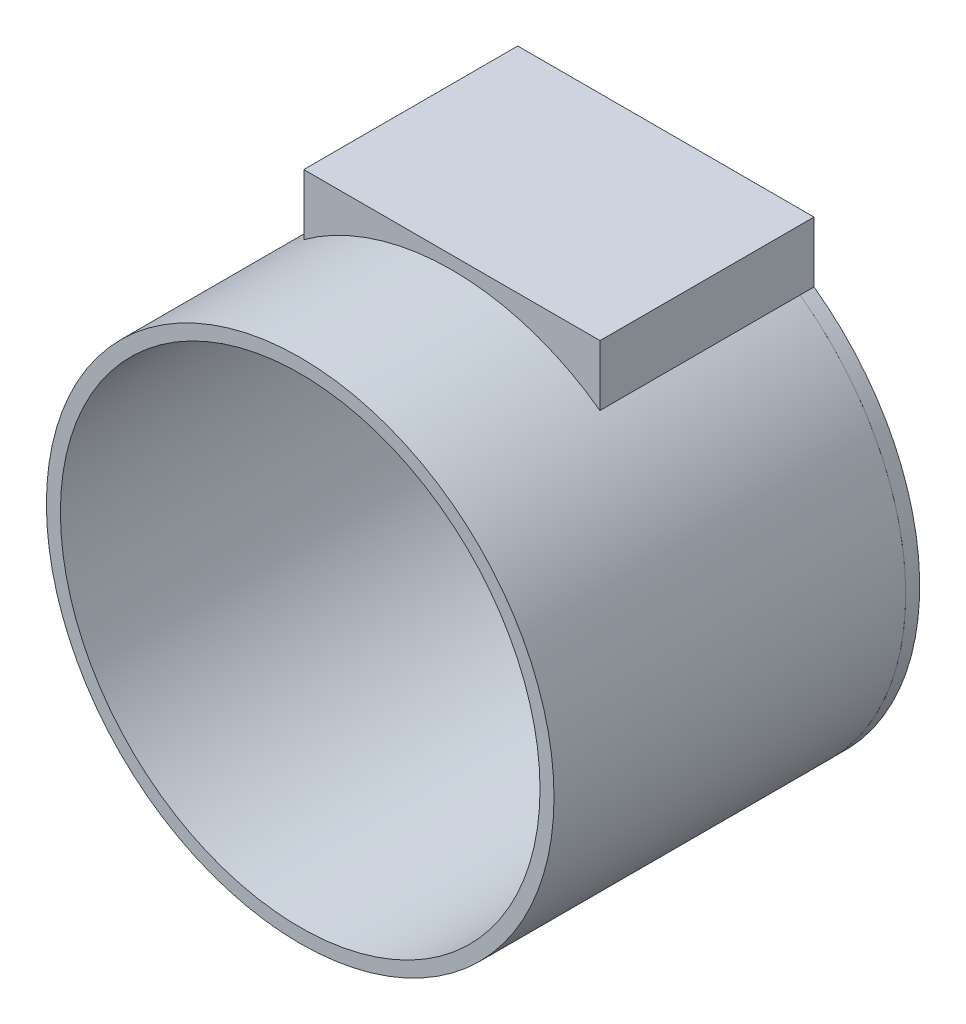
from build123d import *

# Parameters (mm, degrees)
ESQUISSE1_R             = 43.52
ESQUISSE1_R_2           = 1.97
ESQUISSE1_R_3           = 34
BOSS_EXTRU_1_DEPTH      = 2.4
ESQUISSE2_R             = 43.52
ESQUISSE2_R_2           = 41.12
BOSS_EXTRU_2_DEPTH      = 60.3
ESQUISSE3_W             = 50.8
ESQUISSE3_H             = 10.38
BOSS_EXTRU_3_DEPTH      = 34.29
ESQUISSE5_W             = 45.8
ESQUISSE5_H             = 29.29
ENL_V_MAT_EXTRU_2_DEPTH = 9
ESQUISSE6_R             = 41.12
ENL_V_MAT_EXTRU_3_DEPTH = 62


with BuildPart() as part:
    # Esquisse1 → Boss.-Extru.1 (new body)
    # profile 1 of 2: a face of its own
    with BuildSketch(Plane.XY):
        Circle(ESQUISSE1_R)
        with Locations((-38.1, 0)):
            Circle(ESQUISSE1_R_2, mode=Mode.SUBTRACT)
        with Locations((-19.05, -32.995567884)):
            Circle(ESQUISSE1_R_2, mode=Mode.SUBTRACT)
        with Locations((19.05, -32.995567884)):
            Circle(ESQUISSE1_R_2, mode=Mode.SUBTRACT)
        with Locations((38.1, 0)):
            Circle(ESQUISSE1_R_2, mode=Mode.SUBTRACT)
        with Locations((19.05, 32.995567884)):
            Circle(ESQUISSE1_R_2, mode=Mode.SUBTRACT)
        with Locations((-19.05, 32.995567884)):
            Circle(ESQUISSE1_R_2, mode=Mode.SUBTRACT)
        Circle(ESQUISSE1_R_3, mode=Mode.SUBTRACT)
    # profile 2 of 2: a face of its own
    with BuildSketch(Plane.XY):
        with BuildLine():
            ThreePointArc((-25.4, 35.338794547), (0, 43.52), (25.4, 35.338794547))
            Line((25.4, 35.338794547), (25.4, 45.718794547))
            Line((25.4, 45.718794547), (-25.4, 45.718794547))
            Line((-25.4, 45.718794547), (-25.4, 35.338794547))
        make_face()
    extrude(amount=BOSS_EXTRU_1_DEPTH)

    # Esquisse3 → Boss.-Extru.3 (add)
    with BuildSketch(Plane.XY.offset(2.4)):
        with Locations((0, 40.528794547)):
            Rectangle(ESQUISSE3_W, ESQUISSE3_H)
    extrude(amount=BOSS_EXTRU_3_DEPTH)


with BuildPart() as body_2:
    # Esquisse2 → Boss.-Extru.2 (new body)
    with BuildSketch(Plane.XY.offset(2.4)):
        Circle(ESQUISSE2_R)
        Circle(ESQUISSE2_R_2, mode=Mode.SUBTRACT)
    extrude(amount=BOSS_EXTRU_2_DEPTH)


with BuildPart() as enl_v_mat_extru_2_tool:
    # Esquisse5 → Enlèv. mat.-Extru.2 (new body)
    with BuildSketch(Plane.XZ.offset(-35.338794547)):
        with Locations((0, 19.545)):
            Rectangle(ESQUISSE5_W, ESQUISSE5_H)
    extrude(amount=-ENL_V_MAT_EXTRU_2_DEPTH)


with BuildPart() as part_1:
    add(part.part)

    # Enlèv. mat.-Extru.2: cut by enl_v_mat_extru_2_tool
    add(enl_v_mat_extru_2_tool.part, mode=Mode.SUBTRACT)

    # Esquisse6 → Enlèv. mat.-Extru.3 (cut)
    with BuildSketch(Plane.XY.offset(62.7)):
        Circle(ESQUISSE6_R)
    extrude(amount=-ENL_V_MAT_EXTRU_3_DEPTH, mode=Mode.SUBTRACT)


with BuildPart() as body_2_1:
    add(body_2.part)

    # Enlèv. mat.-Extru.2: cut by enl_v_mat_extru_2_tool
    add(enl_v_mat_extru_2_tool.part, mode=Mode.SUBTRACT)


solid = Compound([part_1.part, body_2_1.part])
